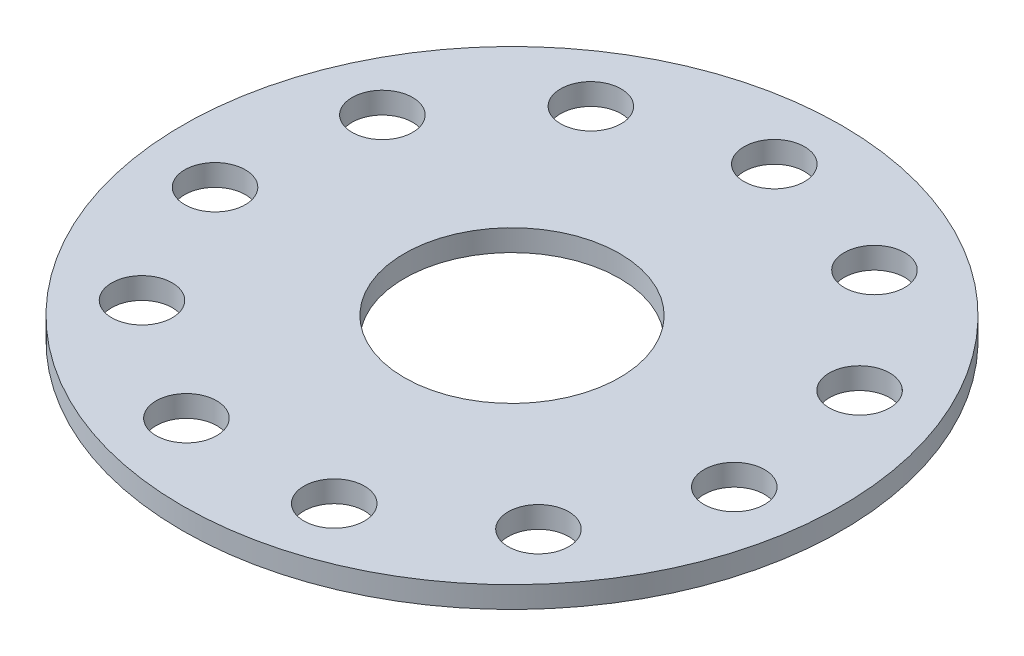
from build123d import *

# Parameters (mm, degrees)
SKETCH1_R           = 24.5
SKETCH1_R_2         = 8
BOSS_EXTRUDE1_DEPTH = 1.6002
SKETCH3_R           = 2.25
CUT_EXTRUDE1_DEPTH  = 35.685164553
CIRPATTERN1_COUNT   = 11


with BuildPart() as part:
    # Sketch1 → Boss-Extrude1 (new body)
    with BuildSketch(Plane(origin=(0, 0, 0), x_dir=(1, 0, 0), z_dir=(0, 1, 0))):
        with Locations(Location((0, 0, 0), (0, 0, 270))):
            Circle(SKETCH1_R)
        with Locations(Location((0, 0, 0), (0, 0, 270))):
            Circle(SKETCH1_R_2, mode=Mode.SUBTRACT)
    extrude(amount=BOSS_EXTRUDE1_DEPTH)

    # Sketch3 → Cut-Extrude1 (cut, through all)
    with BuildSketch(Plane(origin=(0, 1.6002, 0), x_dir=(1, 0, 0), z_dir=(0, 1, 0))):
        with Locations(Location((0, 19.5, 0), (0, 0, 270))):
            Circle(SKETCH3_R)
    cut_extrude1 = extrude(amount=-CUT_EXTRUDE1_DEPTH, mode=Mode.SUBTRACT)

    # CirPattern1: Cut-Extrude1 ×11 about axis
    cirpattern1_axis = Axis((0, 0, 0), (0, 1, 0))
    for i in range(1, CIRPATTERN1_COUNT):
        add(cut_extrude1.rotate(cirpattern1_axis, i * 360 / CIRPATTERN1_COUNT), mode=Mode.SUBTRACT)


solid = part.part
